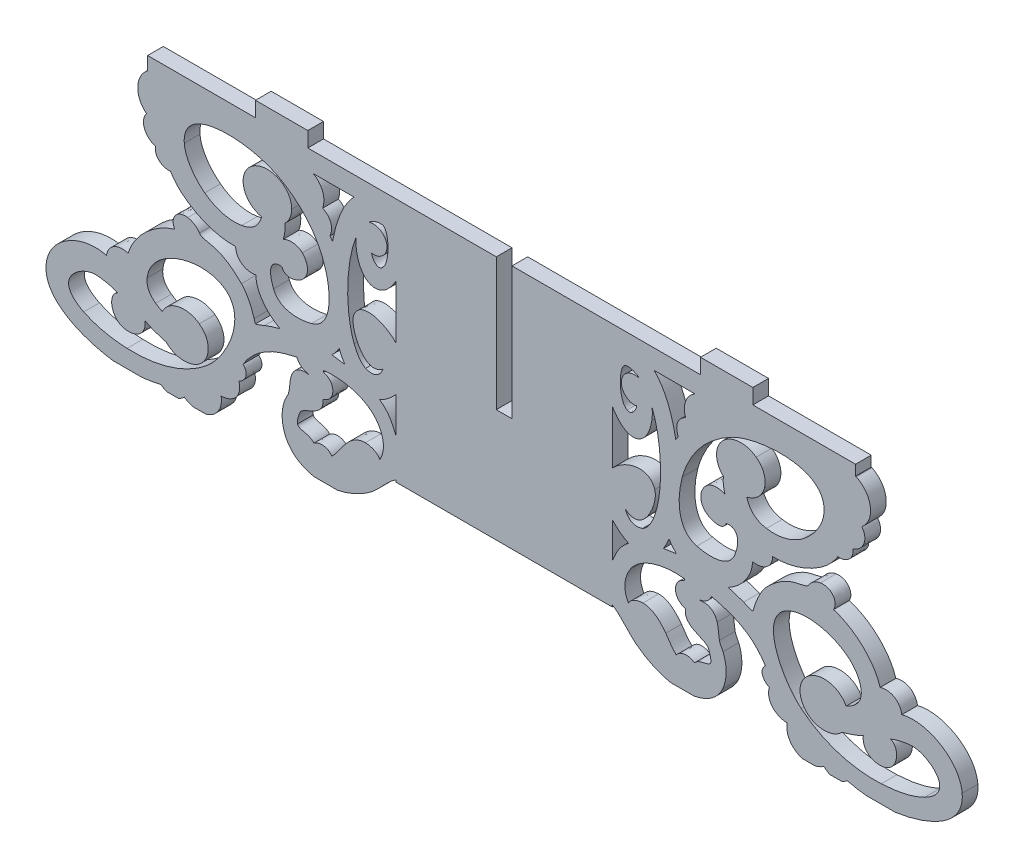
from build123d import *

# Parameters (mm, degrees)
RESSALTO_EXTRUS_O1_DEPTH = 2


with BuildPart() as part:
    # Model → Ressalto-extrusão1 (new body)
    with BuildSketch(Plane.XY):
        with BuildLine():
            Line((-5.6284, -112.7453), (-5.6464, -112.5024))
            add(Edge.make_bspline(
                [(-5.6464, -112.5024), (-6.5419, -112.9865), (-7.8893, -114.6814), (-8.6517, -115.2757)],
                knots=[0.00990099, 0.00990099, 0.00990099, 0.00990099, 0.01980198, 0.01980198, 0.01980198, 0.01980198], degree=3))
            add(Edge.make_bspline(
                [(-8.6517, -115.2757), (-9.9492, -116.2871), (-11.4791, -117.04), (-13.1021, -117.3563)],
                knots=[0.01980198, 0.01980198, 0.01980198, 0.01980198, 0.02970297, 0.02970297, 0.02970297, 0.02970297], degree=3))
            Line((-13.1021, -117.3563), (-16.0542, -117.3569))
            add(Edge.make_bspline(
                [(-16.0542, -117.3569), (-17.6074, -117.0704), (-18.9753, -116.2771), (-19.6727, -114.8027)],
                knots=[0.03960396, 0.03960396, 0.03960396, 0.03960396, 0.04950495, 0.04950495, 0.04950495, 0.04950495], degree=3))
            add(Edge.make_bspline(
                [(-19.6727, -114.8027), (-20.2748, -113.5296), (-20.309, -111.9264), (-19.7445, -110.6272)],
                knots=[0.04950495, 0.04950495, 0.04950495, 0.04950495, 0.059405941, 0.059405941, 0.059405941, 0.059405941], degree=3))
            add(Edge.make_bspline(
                [(-19.7445, -110.6272), (-19.5924, -110.2771), (-19.3699, -109.9824), (-19.2888, -109.595)],
                knots=[0.059405941, 0.059405941, 0.059405941, 0.059405941, 0.069306931, 0.069306931, 0.069306931, 0.069306931], degree=3))
            add(Edge.make_bspline(
                [(-19.2888, -109.595), (-19.1614, -108.9856), (-19.1819, -108.3312), (-18.999, -107.7315)],
                knots=[0.069306931, 0.069306931, 0.069306931, 0.069306931, 0.079207921, 0.079207921, 0.079207921, 0.079207921], degree=3))
            add(Edge.make_bspline(
                [(-18.999, -107.7315), (-18.6689, -106.6497), (-17.8333, -106.246), (-16.8102, -106.4384)],
                knots=[0.079207921, 0.079207921, 0.079207921, 0.079207921, 0.089108911, 0.089108911, 0.089108911, 0.089108911], degree=3))
            add(Edge.make_bspline(
                [(-16.8102, -106.4384), (-16.8066, -106.4196), (-16.8024, -106.4007), (-16.7979, -106.3817)],
                knots=[0.089108911, 0.089108911, 0.089108911, 0.089108911, 0.099009901, 0.099009901, 0.099009901, 0.099009901], degree=3))
            add(Edge.make_bspline(
                [(-16.7979, -106.3817), (-17.4996, -106.2832), (-17.9964, -105.8964), (-18.281, -105.2638)],
                knots=[0.099009901, 0.099009901, 0.099009901, 0.099009901, 0.108910891, 0.108910891, 0.108910891, 0.108910891], degree=3))
            Line((-18.281, -105.2638), (-19.6289, -105.6073))
            add(Edge.make_bspline(
                [(-19.6289, -105.6073), (-21.9055, -106.2199), (-23.8126, -107.3723), (-25.137, -109.472)],
                knots=[0.118811881, 0.118811881, 0.118811881, 0.118811881, 0.128712871, 0.128712871, 0.128712871, 0.128712871], degree=3))
            add(Edge.make_bspline(
                [(-25.137, -109.472), (-24.3471, -110.1811), (-24.768, -111.1844), (-25.6484, -111.6117)],
                knots=[0.128712871, 0.128712871, 0.128712871, 0.128712871, 0.138613861, 0.138613861, 0.138613861, 0.138613861], degree=3))
            add(Edge.make_bspline(
                [(-25.6484, -111.6117), (-25.2197, -113.1217), (-26.2828, -114.3014), (-27.9206, -114.3964)],
                knots=[0.138613861, 0.138613861, 0.138613861, 0.138613861, 0.148514851, 0.148514851, 0.148514851, 0.148514851], degree=3))
            add(Edge.make_bspline(
                [(-27.9206, -114.3964), (-27.6704, -115.807), (-28.5691, -117.0098), (-29.8849, -117.352)],
                knots=[0.148514851, 0.148514851, 0.148514851, 0.148514851, 0.158415842, 0.158415842, 0.158415842, 0.158415842], degree=3))
            Line((-29.8849, -117.352), (-31.4771, -117.3528))
            add(Edge.make_bspline(
                [(-31.4771, -117.3528), (-31.8723, -117.2547), (-32.2526, -117.0856), (-32.6065, -116.8521)],
                knots=[0.168316832, 0.168316832, 0.168316832, 0.168316832, 0.178217822, 0.178217822, 0.178217822, 0.178217822], degree=3))
            add(Edge.make_bspline(
                [(-32.6065, -116.8521), (-32.7813, -117.0214), (-33.1597, -117.3166), (-33.3867, -117.362)],
                knots=[0.178217822, 0.178217822, 0.178217822, 0.178217822, 0.188118812, 0.188118812, 0.188118812, 0.188118812], degree=3))
            Line((-33.3867, -117.362), (-34.8157, -117.362))
            add(Edge.make_bspline(
                [(-34.8157, -117.362), (-35.0116, -117.3252), (-35.4128, -117.07), (-35.5882, -116.9422)],
                knots=[0.198019802, 0.198019802, 0.198019802, 0.198019802, 0.207920792, 0.207920792, 0.207920792, 0.207920792], degree=3))
            add(Edge.make_bspline(
                [(-35.5882, -116.9422), (-36.1338, -117.086), (-37.442, -117.3298), (-37.9546, -117.362)],
                knots=[0.207920792, 0.207920792, 0.207920792, 0.207920792, 0.217821782, 0.217821782, 0.217821782, 0.217821782], degree=3))
            Line((-37.9546, -117.362), (-41.6837, -117.3591))
            add(Edge.make_bspline(
                [(-41.6837, -117.3591), (-44.9016, -116.9194), (-50.559, -115.1316), (-50.1979, -111.0071)],
                knots=[0.227722772, 0.227722772, 0.227722772, 0.227722772, 0.237623762, 0.237623762, 0.237623762, 0.237623762], degree=3))
            add(Edge.make_bspline(
                [(-50.1979, -111.0071), (-49.9051, -107.6597), (-45.7279, -105.3202), (-42.5097, -106.1811)],
                knots=[0.237623762, 0.237623762, 0.237623762, 0.237623762, 0.247524752, 0.247524752, 0.247524752, 0.247524752], degree=3))
            add(Edge.make_bspline(
                [(-42.5097, -106.1811), (-42.3406, -104.9368), (-41.1513, -104.1223), (-39.7553, -104.5529)],
                knots=[0.247524752, 0.247524752, 0.247524752, 0.247524752, 0.257425743, 0.257425743, 0.257425743, 0.257425743], degree=3))
            add(Edge.make_bspline(
                [(-39.7553, -104.5529), (-38.9652, -101.9343), (-36.3648, -99.6933), (-33.825, -98.9411)],
                knots=[0.257425743, 0.257425743, 0.257425743, 0.257425743, 0.267326733, 0.267326733, 0.267326733, 0.267326733], degree=3))
            add(Edge.make_bspline(
                [(-33.825, -98.9411), (-34.4145, -97.9132), (-33.6513, -96.6265), (-32.1639, -96.8236)],
                knots=[0.267326733, 0.267326733, 0.267326733, 0.267326733, 0.277227723, 0.277227723, 0.277227723, 0.277227723], degree=3))
            add(Edge.make_bspline(
                [(-32.1639, -96.8236), (-31.6489, -96.8918), (-30.977, -97.2747), (-30.6727, -97.7933)],
                knots=[0.277227723, 0.277227723, 0.277227723, 0.277227723, 0.287128713, 0.287128713, 0.287128713, 0.287128713], degree=3))
            add(Edge.make_bspline(
                [(-30.6727, -97.7933), (-30.2008, -98.5978), (-28.3124, -97.6373), (-25.3267, -100.6883)],
                knots=[0.287128713, 0.287128713, 0.287128713, 0.287128713, 0.297029703, 0.297029703, 0.297029703, 0.297029703], degree=3))
            add(Edge.make_bspline(
                [(-25.3267, -100.6883), (-24.602, -101.4287), (-24.0346, -102.6503), (-23.718, -103.7243)],
                knots=[0.297029703, 0.297029703, 0.297029703, 0.297029703, 0.306930693, 0.306930693, 0.306930693, 0.306930693], degree=3))
            add(Edge.make_bspline(
                [(-23.718, -103.7243), (-23.6918, -103.8135), (-23.611, -104.1406), (-23.5594, -104.2593)],
                knots=[0.306930693, 0.306930693, 0.306930693, 0.306930693, 0.316831683, 0.316831683, 0.316831683, 0.316831683], degree=3))
            add(Edge.make_bspline(
                [(-23.5594, -104.2593), (-23.2891, -104.2271), (-22.6447, -103.9373), (-22.3768, -103.8363)],
                knots=[0.316831683, 0.316831683, 0.316831683, 0.316831683, 0.326732673, 0.326732673, 0.326732673, 0.326732673], degree=3))
            add(Edge.make_bspline(
                [(-22.3768, -103.8363), (-21.7257, -103.591), (-21.0761, -103.3756), (-20.4179, -103.1989)],
                knots=[0.326732673, 0.326732673, 0.326732673, 0.326732673, 0.336633663, 0.336633663, 0.336633663, 0.336633663], degree=3))
            add(Edge.make_bspline(
                [(-20.4179, -103.1989), (-22.012, -102.3364), (-23.4449, -100.7002), (-23.5064, -98.8133)],
                knots=[0.336633663, 0.336633663, 0.336633663, 0.336633663, 0.346534653, 0.346534653, 0.346534653, 0.346534653], degree=3))
            add(Edge.make_bspline(
                [(-23.5064, -98.8133), (-24.7892, -99.0637), (-26.0243, -98.3309), (-26.0724, -96.9712)],
                knots=[0.346534653, 0.346534653, 0.346534653, 0.346534653, 0.356435644, 0.356435644, 0.356435644, 0.356435644], degree=3))
            add(Edge.make_bspline(
                [(-26.0724, -96.9712), (-28.4957, -97.0677), (-31.1466, -96.0514), (-32.9791, -94.4712)],
                knots=[0.356435644, 0.356435644, 0.356435644, 0.356435644, 0.366336634, 0.366336634, 0.366336634, 0.366336634], degree=3))
            add(Edge.make_bspline(
                [(-32.9791, -94.4712), (-33.492, -94.0288), (-33.9776, -93.4401), (-34.3711, -92.825)],
                knots=[0.366336634, 0.366336634, 0.366336634, 0.366336634, 0.376237624, 0.376237624, 0.376237624, 0.376237624], degree=3))
            add(Edge.make_bspline(
                [(-34.3711, -92.825), (-35.3634, -92.9517), (-36.4953, -92.1626), (-36.2723, -91.0278)],
                knots=[0.376237624, 0.376237624, 0.376237624, 0.376237624, 0.386138614, 0.386138614, 0.386138614, 0.386138614], degree=3))
            add(Edge.make_bspline(
                [(-36.2723, -91.0278), (-37.635, -90.5862), (-38.2812, -89.0905), (-37.4127, -87.9969)],
                knots=[0.386138614, 0.386138614, 0.386138614, 0.386138614, 0.396039604, 0.396039604, 0.396039604, 0.396039604], degree=3))
            add(Edge.make_bspline(
                [(-37.4127, -87.9969), (-39.0338, -86.6952), (-38.818, -84.3676), (-37.2753, -83.1991)],
                knots=[0.396039604, 0.396039604, 0.396039604, 0.396039604, 0.405940594, 0.405940594, 0.405940594, 0.405940594], degree=3))
            Line((-37.2753, -83.1991), (-37.2753, -81.5107))
            Line((-37.2753, -81.5107), (-23.5478, -81.5107))
            Line((-23.5478, -81.5107), (-23.5478, -79.5846))
            Line((-23.5478, -79.5846), (-16.8811, -79.5846))
            Line((-16.8811, -79.5846), (-16.8811, -81.5107))
            Line((-16.8811, -81.5107), (7.1189, -81.5107))
            Line((7.1189, -81.5107), (7.1189, -98.3678))
            Line((7.1189, -98.3678), (9.1189, -98.3678))
            Line((9.1189, -98.3678), (9.1189, -81.5107))
            Line((9.1189, -81.5107), (33.1189, -81.5107))
            Line((33.1189, -81.5107), (33.1189, -79.5846))
            Line((33.1189, -79.5846), (39.7856, -79.5846))
            Line((39.7856, -79.5846), (39.7856, -81.5107))
            Line((39.7856, -81.5107), (52.8602, -81.5107))
            Line((52.8602, -81.5107), (52.8602, -82.8287))
            Line((52.8602, -82.8287), (52.8959, -82.8287))
            Line((52.8959, -82.8287), (52.9623, -82.861))
            add(Edge.make_bspline(
                [(52.9623, -82.861), (54.9872, -83.848), (55.4482, -86.5534), (53.6504, -87.9969)],
                knots=[0.574257426, 0.574257426, 0.574257426, 0.574257426, 0.584158416, 0.584158416, 0.584158416, 0.584158416], degree=3))
            add(Edge.make_bspline(
                [(53.6504, -87.9969), (54.519, -89.0905), (53.8727, -90.5862), (52.5101, -91.0278)],
                knots=[0.584158416, 0.584158416, 0.584158416, 0.584158416, 0.594059406, 0.594059406, 0.594059406, 0.594059406], degree=3))
            add(Edge.make_bspline(
                [(52.5101, -91.0278), (52.733, -92.1626), (51.6012, -92.9517), (50.6088, -92.825)],
                knots=[0.594059406, 0.594059406, 0.594059406, 0.594059406, 0.603960396, 0.603960396, 0.603960396, 0.603960396], degree=3))
            add(Edge.make_bspline(
                [(50.6088, -92.825), (50.2153, -93.4401), (49.7298, -94.0288), (49.2168, -94.4712)],
                knots=[0.603960396, 0.603960396, 0.603960396, 0.603960396, 0.613861386, 0.613861386, 0.613861386, 0.613861386], degree=3))
            add(Edge.make_bspline(
                [(49.2168, -94.4712), (47.3843, -96.0514), (44.7334, -97.0677), (42.3101, -96.9712)],
                knots=[0.613861386, 0.613861386, 0.613861386, 0.613861386, 0.623762376, 0.623762376, 0.623762376, 0.623762376], degree=3))
            add(Edge.make_bspline(
                [(42.3101, -96.9712), (42.262, -98.3309), (41.027, -99.0637), (39.7442, -98.8133)],
                knots=[0.623762376, 0.623762376, 0.623762376, 0.623762376, 0.633663366, 0.633663366, 0.633663366, 0.633663366], degree=3))
            add(Edge.make_bspline(
                [(39.7442, -98.8133), (39.6827, -100.7002), (38.2497, -102.3364), (36.6556, -103.1989)],
                knots=[0.633663366, 0.633663366, 0.633663366, 0.633663366, 0.643564356, 0.643564356, 0.643564356, 0.643564356], degree=3))
            add(Edge.make_bspline(
                [(36.6556, -103.1989), (37.3138, -103.3756), (37.9634, -103.591), (38.6145, -103.8363)],
                knots=[0.643564356, 0.643564356, 0.643564356, 0.643564356, 0.653465347, 0.653465347, 0.653465347, 0.653465347], degree=3))
            add(Edge.make_bspline(
                [(38.6145, -103.8363), (38.8825, -103.9373), (39.5268, -104.2271), (39.7971, -104.2593)],
                knots=[0.653465347, 0.653465347, 0.653465347, 0.653465347, 0.663366337, 0.663366337, 0.663366337, 0.663366337], degree=3))
            add(Edge.make_bspline(
                [(39.7971, -104.2593), (39.8487, -104.1406), (39.9295, -103.8135), (39.9557, -103.7243)],
                knots=[0.663366337, 0.663366337, 0.663366337, 0.663366337, 0.673267327, 0.673267327, 0.673267327, 0.673267327], degree=3))
            add(Edge.make_bspline(
                [(39.9557, -103.7243), (40.2723, -102.6503), (40.8398, -101.4287), (41.5644, -100.6883)],
                knots=[0.673267327, 0.673267327, 0.673267327, 0.673267327, 0.683168317, 0.683168317, 0.683168317, 0.683168317], degree=3))
            add(Edge.make_bspline(
                [(41.5644, -100.6883), (44.5501, -97.6373), (46.4385, -98.5978), (46.9105, -97.7933)],
                knots=[0.683168317, 0.683168317, 0.683168317, 0.683168317, 0.693069307, 0.693069307, 0.693069307, 0.693069307], degree=3))
            add(Edge.make_bspline(
                [(46.9105, -97.7933), (47.2147, -97.2747), (47.8867, -96.8918), (48.4016, -96.8236)],
                knots=[0.693069307, 0.693069307, 0.693069307, 0.693069307, 0.702970297, 0.702970297, 0.702970297, 0.702970297], degree=3))
            add(Edge.make_bspline(
                [(48.4016, -96.8236), (49.8891, -96.6265), (50.6522, -97.9132), (50.0628, -98.9411)],
                knots=[0.702970297, 0.702970297, 0.702970297, 0.702970297, 0.712871287, 0.712871287, 0.712871287, 0.712871287], degree=3))
            add(Edge.make_bspline(
                [(50.0628, -98.9411), (52.6026, -99.6933), (55.2029, -101.9343), (55.9931, -104.5529)],
                knots=[0.712871287, 0.712871287, 0.712871287, 0.712871287, 0.722772277, 0.722772277, 0.722772277, 0.722772277], degree=3))
            add(Edge.make_bspline(
                [(55.9931, -104.5529), (57.389, -104.1223), (58.5783, -104.9368), (58.7475, -106.1811)],
                knots=[0.722772277, 0.722772277, 0.722772277, 0.722772277, 0.732673267, 0.732673267, 0.732673267, 0.732673267], degree=3))
            add(Edge.make_bspline(
                [(58.7475, -106.1811), (61.9656, -105.3202), (66.1428, -107.6597), (66.4357, -111.0071)],
                knots=[0.732673267, 0.732673267, 0.732673267, 0.732673267, 0.742574257, 0.742574257, 0.742574257, 0.742574257], degree=3))
            add(Edge.make_bspline(
                [(66.4357, -111.0071), (66.7967, -115.1316), (61.1393, -116.9194), (57.9215, -117.3591)],
                knots=[0.742574257, 0.742574257, 0.742574257, 0.742574257, 0.752475248, 0.752475248, 0.752475248, 0.752475248], degree=3))
            Line((57.9215, -117.3591), (54.1924, -117.362))
            add(Edge.make_bspline(
                [(54.1924, -117.362), (53.6797, -117.3298), (52.3716, -117.086), (51.826, -116.9422)],
                knots=[0.762376238, 0.762376238, 0.762376238, 0.762376238, 0.772277228, 0.772277228, 0.772277228, 0.772277228], degree=3))
            add(Edge.make_bspline(
                [(51.826, -116.9422), (51.6505, -117.07), (51.2493, -117.3252), (51.0535, -117.362)],
                knots=[0.772277228, 0.772277228, 0.772277228, 0.772277228, 0.782178218, 0.782178218, 0.782178218, 0.782178218], degree=3))
            Line((51.0535, -117.362), (49.6245, -117.362))
            add(Edge.make_bspline(
                [(49.6245, -117.362), (49.3974, -117.3166), (49.019, -117.0214), (48.8442, -116.8521)],
                knots=[0.792079208, 0.792079208, 0.792079208, 0.792079208, 0.801980198, 0.801980198, 0.801980198, 0.801980198], degree=3))
            add(Edge.make_bspline(
                [(48.8442, -116.8521), (48.4903, -117.0856), (48.11, -117.2547), (47.7148, -117.3528)],
                knots=[0.801980198, 0.801980198, 0.801980198, 0.801980198, 0.811881188, 0.811881188, 0.811881188, 0.811881188], degree=3))
            Line((47.7148, -117.3528), (46.1226, -117.352))
            add(Edge.make_bspline(
                [(46.1226, -117.352), (44.8069, -117.0098), (43.9081, -115.807), (44.1584, -114.3964)],
                knots=[0.821782178, 0.821782178, 0.821782178, 0.821782178, 0.831683168, 0.831683168, 0.831683168, 0.831683168], degree=3))
            add(Edge.make_bspline(
                [(44.1584, -114.3964), (42.5205, -114.3014), (41.4574, -113.1217), (41.8862, -111.6117)],
                knots=[0.831683168, 0.831683168, 0.831683168, 0.831683168, 0.841584158, 0.841584158, 0.841584158, 0.841584158], degree=3))
            add(Edge.make_bspline(
                [(41.8862, -111.6117), (41.0057, -111.1844), (40.5849, -110.1811), (41.3748, -109.472)],
                knots=[0.841584158, 0.841584158, 0.841584158, 0.841584158, 0.851485149, 0.851485149, 0.851485149, 0.851485149], degree=3))
            add(Edge.make_bspline(
                [(41.3748, -109.472), (40.0503, -107.3723), (38.1433, -106.2199), (35.8666, -105.6073)],
                knots=[0.851485149, 0.851485149, 0.851485149, 0.851485149, 0.861386139, 0.861386139, 0.861386139, 0.861386139], degree=3))
            Line((35.8666, -105.6073), (34.5187, -105.2638))
            add(Edge.make_bspline(
                [(34.5187, -105.2638), (34.2342, -105.8964), (33.7373, -106.2832), (33.0357, -106.3817)],
                knots=[0.871287129, 0.871287129, 0.871287129, 0.871287129, 0.881188119, 0.881188119, 0.881188119, 0.881188119], degree=3))
            add(Edge.make_bspline(
                [(33.0357, -106.3817), (33.0401, -106.4007), (33.0443, -106.4196), (33.048, -106.4384)],
                knots=[0.881188119, 0.881188119, 0.881188119, 0.881188119, 0.891089109, 0.891089109, 0.891089109, 0.891089109], degree=3))
            add(Edge.make_bspline(
                [(33.048, -106.4384), (34.071, -106.246), (34.9066, -106.6497), (35.2367, -107.7315)],
                knots=[0.891089109, 0.891089109, 0.891089109, 0.891089109, 0.900990099, 0.900990099, 0.900990099, 0.900990099], degree=3))
            add(Edge.make_bspline(
                [(35.2367, -107.7315), (35.4196, -108.3312), (35.3992, -108.9856), (35.5266, -109.595)],
                knots=[0.900990099, 0.900990099, 0.900990099, 0.900990099, 0.910891089, 0.910891089, 0.910891089, 0.910891089], degree=3))
            add(Edge.make_bspline(
                [(35.5266, -109.595), (35.6076, -109.9824), (35.8302, -110.2771), (35.9823, -110.6272)],
                knots=[0.910891089, 0.910891089, 0.910891089, 0.910891089, 0.920792079, 0.920792079, 0.920792079, 0.920792079], degree=3))
            add(Edge.make_bspline(
                [(35.9823, -110.6272), (36.5467, -111.9264), (36.5126, -113.5296), (35.9104, -114.8027)],
                knots=[0.920792079, 0.920792079, 0.920792079, 0.920792079, 0.930693069, 0.930693069, 0.930693069, 0.930693069], degree=3))
            add(Edge.make_bspline(
                [(35.9104, -114.8027), (35.2131, -116.2771), (33.8452, -117.0704), (32.2919, -117.3569)],
                knots=[0.930693069, 0.930693069, 0.930693069, 0.930693069, 0.940594059, 0.940594059, 0.940594059, 0.940594059], degree=3))
            Line((32.2919, -117.3569), (29.3398, -117.3563))
            add(Edge.make_bspline(
                [(29.3398, -117.3563), (27.7168, -117.04), (26.1869, -116.2871), (24.8894, -115.2757)],
                knots=[0.95049505, 0.95049505, 0.95049505, 0.95049505, 0.96039604, 0.96039604, 0.96039604, 0.96039604], degree=3))
            add(Edge.make_bspline(
                [(24.8894, -115.2757), (24.127, -114.6814), (22.7796, -112.9865), (21.8841, -112.5024)],
                knots=[0.96039604, 0.96039604, 0.96039604, 0.96039604, 0.97029703, 0.97029703, 0.97029703, 0.97029703], degree=3))
            Line((21.8841, -112.5024), (21.8661, -112.7453))
            add(Edge.make_bspline(
                [(21.8661, -112.7453), (12.8258, -112.7453), (3.4119, -112.7453), (-5.6284, -112.7453)],
                knots=[0.98019802, 0.98019802, 0.98019802, 0.98019802, 1, 1, 1, 1], degree=3))
        make_face()
        with BuildLine():
            Line((-10.9876, -83.9801), (-16.2025, -83.9801))
            add(Edge.make_bspline(
                [(-16.2025, -83.9801), (-15.1507, -84.5589), (-14.5218, -85.7771), (-14.9827, -87.1985)],
                knots=[0, 0, 0, 0, 0.166666667, 0.166666667, 0.166666667, 0.166666667], degree=3))
            add(Edge.make_bspline(
                [(-14.9827, -87.1985), (-13.9248, -87.7097), (-13.6065, -88.7057), (-14.0462, -89.782)],
                knots=[0.166666667, 0.166666667, 0.166666667, 0.166666667, 0.333333333, 0.333333333, 0.333333333, 0.333333333], degree=3))
            add(Edge.make_bspline(
                [(-14.0462, -89.782), (-13.9394, -89.9313), (-13.8344, -90.0899), (-13.7323, -90.2521)],
                knots=[0.333333333, 0.333333333, 0.333333333, 0.333333333, 0.5, 0.5, 0.5, 0.5], degree=3))
            add(Edge.make_bspline(
                [(-13.7323, -90.2521), (-13.3251, -87.9243), (-12.4877, -85.4672), (-10.9876, -83.9801)],
                knots=[0.5, 0.5, 0.5, 0.5, 0.666666667, 0.666666667, 0.666666667, 0.666666667], degree=3))
        make_face(mode=Mode.SUBTRACT)
        with BuildLine():
            Line((32.4403, -83.9801), (27.2253, -83.9801))
            add(Edge.make_bspline(
                [(27.2253, -83.9801), (28.7254, -85.4672), (29.5629, -87.9243), (29.97, -90.2521)],
                knots=[0, 0, 0, 0, 0.166666667, 0.166666667, 0.166666667, 0.166666667], degree=3))
            add(Edge.make_bspline(
                [(29.97, -90.2521), (30.0721, -90.0899), (30.1772, -89.9313), (30.2839, -89.782)],
                knots=[0.166666667, 0.166666667, 0.166666667, 0.166666667, 0.333333333, 0.333333333, 0.333333333, 0.333333333], degree=3))
            add(Edge.make_bspline(
                [(30.2839, -89.782), (29.8442, -88.7057), (30.1626, -87.7097), (31.2204, -87.1985)],
                knots=[0.333333333, 0.333333333, 0.333333333, 0.333333333, 0.5, 0.5, 0.5, 0.5], degree=3))
            add(Edge.make_bspline(
                [(31.2204, -87.1985), (30.7596, -85.7771), (31.3885, -84.5589), (32.4403, -83.9801)],
                knots=[0.5, 0.5, 0.5, 0.5, 0.666666667, 0.666666667, 0.666666667, 0.666666667], degree=3))
        make_face(mode=Mode.SUBTRACT)
        with BuildLine():
            Line((21.8983, -107.6195), (21.8983, -103.0943))
            add(Edge.make_bspline(
                [(21.8983, -103.0943), (22.4767, -103.7415), (23.2107, -104.3434), (23.9781, -104.6802)],
                knots=[0.25, 0.25, 0.25, 0.25, 0.5, 0.5, 0.5, 0.5], degree=3))
            add(Edge.make_bspline(
                [(23.9781, -104.6802), (22.8318, -105.493), (22.4114, -106.3816), (21.8983, -107.6195)],
                knots=[0.5, 0.5, 0.5, 0.5, 1, 1, 1, 1], degree=3))
        make_face(mode=Mode.SUBTRACT)
        with BuildLine():
            Line((21.8983, -97.4057), (21.8983, -90.5812))
            add(Edge.make_bspline(
                [(21.8983, -90.5812), (23.715, -93.8349), (26.3849, -93.1363), (26.9173, -89.6854)],
                knots=[0.363636364, 0.363636364, 0.363636364, 0.363636364, 0.454545455, 0.454545455, 0.454545455, 0.454545455], degree=3))
            add(Edge.make_bspline(
                [(26.9173, -89.6854), (26.9939, -89.1892), (27.0085, -88.6836), (26.9564, -88.2068)],
                knots=[0.454545455, 0.454545455, 0.454545455, 0.454545455, 0.545454545, 0.545454545, 0.545454545, 0.545454545], degree=3))
            add(Edge.make_bspline(
                [(26.9564, -88.2068), (28.2487, -91.4505), (28.451, -96.9108), (27.213, -100.145)],
                knots=[0.545454545, 0.545454545, 0.545454545, 0.545454545, 0.636363636, 0.636363636, 0.636363636, 0.636363636], degree=3))
            add(Edge.make_bspline(
                [(27.213, -100.145), (26.9098, -100.9371), (26.4428, -101.7745), (25.7631, -102.1337)],
                knots=[0.636363636, 0.636363636, 0.636363636, 0.636363636, 0.727272727, 0.727272727, 0.727272727, 0.727272727], degree=3))
            add(Edge.make_bspline(
                [(25.7631, -102.1337), (25.054, -102.3989), (24.3, -102.3651), (23.8014, -101.6136)],
                knots=[0.727272727, 0.727272727, 0.727272727, 0.727272727, 0.818181818, 0.818181818, 0.818181818, 0.818181818], degree=3))
            add(Edge.make_bspline(
                [(23.8014, -101.6136), (23.6985, -101.4585), (23.6152, -101.2845), (23.5508, -101.1004)],
                knots=[0.818181818, 0.818181818, 0.818181818, 0.818181818, 1, 1, 1, 1], degree=3))
            add(Edge.make_bspline(
                [(23.5508, -101.1004), (23.9717, -101.4816), (24.5568, -101.6481), (25.0819, -101.5176)],
                knots=[0, 0, 0, 0, 0.090909091, 0.090909091, 0.090909091, 0.090909091], degree=3))
            add(Edge.make_bspline(
                [(25.0819, -101.5176), (26.5124, -101.1622), (27.6791, -98.283), (27.2955, -97.0934)],
                knots=[0.090909091, 0.090909091, 0.090909091, 0.090909091, 0.181818182, 0.181818182, 0.181818182, 0.181818182], degree=3))
            add(Edge.make_bspline(
                [(27.2955, -97.0934), (26.5745, -94.8575), (23.4797, -95.7308), (21.8983, -97.4057)],
                knots=[0.181818182, 0.181818182, 0.181818182, 0.181818182, 0.272727273, 0.272727273, 0.272727273, 0.272727273], degree=3))
        make_face(mode=Mode.SUBTRACT)
        with BuildLine():
            Line((30.061, -102.7829), (28.4015, -103.0293))
            add(Edge.make_bspline(
                [(28.4015, -103.0293), (28.6801, -102.5939), (28.9165, -102.111), (29.1159, -101.617)],
                knots=[0.25, 0.25, 0.25, 0.25, 0.5, 0.5, 0.5, 0.5], degree=3))
            add(Edge.make_bspline(
                [(29.1159, -101.617), (29.3835, -102.0615), (29.6983, -102.454), (30.061, -102.7829)],
                knots=[0.5, 0.5, 0.5, 0.5, 1, 1, 1, 1], degree=3))
        make_face(mode=Mode.SUBTRACT)
        with BuildLine():
            Line((-5.6605, -107.6195), (-5.6605, -103.0943))
            add(Edge.make_bspline(
                [(-5.6605, -103.0943), (-6.239, -103.7415), (-6.9729, -104.3434), (-7.7404, -104.6802)],
                knots=[0.25, 0.25, 0.25, 0.25, 0.5, 0.5, 0.5, 0.5], degree=3))
            add(Edge.make_bspline(
                [(-7.7404, -104.6802), (-6.5941, -105.493), (-6.1737, -106.3816), (-5.6605, -107.6195)],
                knots=[0.5, 0.5, 0.5, 0.5, 1, 1, 1, 1], degree=3))
        make_face(mode=Mode.SUBTRACT)
        with BuildLine():
            Line((-5.6605, -97.4057), (-5.6605, -90.5812))
            add(Edge.make_bspline(
                [(-5.6605, -90.5812), (-7.4773, -93.8349), (-10.1472, -93.1363), (-10.6795, -89.6854)],
                knots=[0.363636364, 0.363636364, 0.363636364, 0.363636364, 0.454545455, 0.454545455, 0.454545455, 0.454545455], degree=3))
            add(Edge.make_bspline(
                [(-10.6795, -89.6854), (-10.7561, -89.1892), (-10.7708, -88.6836), (-10.7187, -88.2068)],
                knots=[0.454545455, 0.454545455, 0.454545455, 0.454545455, 0.545454545, 0.545454545, 0.545454545, 0.545454545], degree=3))
            add(Edge.make_bspline(
                [(-10.7187, -88.2068), (-12.011, -91.4505), (-12.2132, -96.9108), (-10.9753, -100.145)],
                knots=[0.545454545, 0.545454545, 0.545454545, 0.545454545, 0.636363636, 0.636363636, 0.636363636, 0.636363636], degree=3))
            add(Edge.make_bspline(
                [(-10.9753, -100.145), (-10.6721, -100.9371), (-10.205, -101.7745), (-9.5254, -102.1337)],
                knots=[0.636363636, 0.636363636, 0.636363636, 0.636363636, 0.727272727, 0.727272727, 0.727272727, 0.727272727], degree=3))
            add(Edge.make_bspline(
                [(-9.5254, -102.1337), (-8.8163, -102.3989), (-8.0623, -102.3651), (-7.5637, -101.6136)],
                knots=[0.727272727, 0.727272727, 0.727272727, 0.727272727, 0.818181818, 0.818181818, 0.818181818, 0.818181818], degree=3))
            add(Edge.make_bspline(
                [(-7.5637, -101.6136), (-7.4608, -101.4585), (-7.3775, -101.2845), (-7.3131, -101.1004)],
                knots=[0.818181818, 0.818181818, 0.818181818, 0.818181818, 1, 1, 1, 1], degree=3))
            add(Edge.make_bspline(
                [(-7.3131, -101.1004), (-7.734, -101.4816), (-8.3191, -101.6481), (-8.8441, -101.5176)],
                knots=[0, 0, 0, 0, 0.090909091, 0.090909091, 0.090909091, 0.090909091], degree=3))
            add(Edge.make_bspline(
                [(-8.8441, -101.5176), (-10.2747, -101.1622), (-11.4413, -98.283), (-11.0577, -97.0934)],
                knots=[0.090909091, 0.090909091, 0.090909091, 0.090909091, 0.181818182, 0.181818182, 0.181818182, 0.181818182], degree=3))
            add(Edge.make_bspline(
                [(-11.0577, -97.0934), (-10.3368, -94.8575), (-7.2419, -95.7308), (-5.6605, -97.4057)],
                knots=[0.181818182, 0.181818182, 0.181818182, 0.181818182, 0.272727273, 0.272727273, 0.272727273, 0.272727273], degree=3))
        make_face(mode=Mode.SUBTRACT)
        with BuildLine():
            Line((-13.8232, -102.7829), (-12.1638, -103.0293))
            add(Edge.make_bspline(
                [(-12.1638, -103.0293), (-12.4424, -102.5939), (-12.6788, -102.111), (-12.8781, -101.617)],
                knots=[0.25, 0.25, 0.25, 0.25, 0.5, 0.5, 0.5, 0.5], degree=3))
            add(Edge.make_bspline(
                [(-12.8781, -101.617), (-13.1457, -102.0615), (-13.4606, -102.454), (-13.8232, -102.7829)],
                knots=[0.5, 0.5, 0.5, 0.5, 1, 1, 1, 1], degree=3))
        make_face(mode=Mode.SUBTRACT)
        with BuildLine():
            add(Edge.make_bspline(
                [(25.3652, -85.8031), (23.4778, -85.2427), (22.2258, -87.425), (23.6524, -88.664)],
                knots=[0, 0, 0, 0, 0.166666667, 0.166666667, 0.166666667, 0.166666667], degree=3))
            add(Edge.make_bspline(
                [(23.6524, -88.664), (24.0428, -89.0031), (24.532, -89.1242), (25.0001, -89.0115)],
                knots=[0.166666667, 0.166666667, 0.166666667, 0.166666667, 0.333333333, 0.333333333, 0.333333333, 0.333333333], degree=3))
            add(Edge.make_bspline(
                [(25.0001, -89.0115), (24.9505, -89.519), (24.3805, -90.3951), (23.7771, -90.072)],
                knots=[0.333333333, 0.333333333, 0.333333333, 0.333333333, 0.5, 0.5, 0.5, 0.5], degree=3))
            add(Edge.make_bspline(
                [(23.7771, -90.072), (22.6078, -89.4459), (22.6642, -85.3539), (23.6446, -85.2345)],
                knots=[0.5, 0.5, 0.5, 0.5, 0.666666667, 0.666666667, 0.666666667, 0.666666667], degree=3))
            add(Edge.make_bspline(
                [(23.6446, -85.2345), (24.2518, -85.1606), (24.8926, -85.4231), (25.3652, -85.8031)],
                knots=[0.666666667, 0.666666667, 0.666666667, 0.666666667, 1, 1, 1, 1], degree=3))
        make_face(mode=Mode.SUBTRACT)
        with BuildLine():
            add(Edge.make_bspline(
                [(36.0381, -91.2717), (35.9571, -91.9263), (36.0478, -92.518), (36.2461, -93.1381)],
                knots=[0, 0, 0, 0, 0.058823529, 0.058823529, 0.058823529, 0.058823529], degree=3))
            add(Edge.make_bspline(
                [(36.2461, -93.1381), (35.4573, -92.77), (34.4529, -92.7857), (33.8083, -93.4305)],
                knots=[0.058823529, 0.058823529, 0.058823529, 0.058823529, 0.117647059, 0.117647059, 0.117647059, 0.117647059], degree=3))
            add(Edge.make_bspline(
                [(33.8083, -93.4305), (32.824, -94.4151), (32.906, -96.043), (34.3932, -96.72)],
                knots=[0.117647059, 0.117647059, 0.117647059, 0.117647059, 0.176470588, 0.176470588, 0.176470588, 0.176470588], degree=3))
            add(Edge.make_bspline(
                [(34.3932, -96.72), (35.0481, -97.0182), (36.1044, -97.1431), (36.38, -96.2826)],
                knots=[0.176470588, 0.176470588, 0.176470588, 0.176470588, 0.235294118, 0.235294118, 0.235294118, 0.235294118], degree=3))
            add(Edge.make_bspline(
                [(36.38, -96.2826), (36.7529, -96.1892), (37.1846, -96.2244), (37.4917, -96.5126)],
                knots=[0.235294118, 0.235294118, 0.235294118, 0.235294118, 0.294117647, 0.294117647, 0.294117647, 0.294117647], degree=3))
            add(Edge.make_bspline(
                [(37.4917, -96.5126), (38.1562, -97.136), (37.7715, -98.4847), (37.4787, -99.2187)],
                knots=[0.294117647, 0.294117647, 0.294117647, 0.294117647, 0.352941176, 0.352941176, 0.352941176, 0.352941176], degree=3))
            add(Edge.make_bspline(
                [(37.4787, -99.2187), (36.7026, -101.1641), (34.098, -101.0219), (32.653, -100.6401)],
                knots=[0.352941176, 0.352941176, 0.352941176, 0.352941176, 0.411764706, 0.411764706, 0.411764706, 0.411764706], degree=3))
            add(Edge.make_bspline(
                [(32.653, -100.6401), (29.9072, -99.9146), (30.2036, -96.0743), (30.8, -93.9515)],
                knots=[0.411764706, 0.411764706, 0.411764706, 0.411764706, 0.470588235, 0.470588235, 0.470588235, 0.470588235], degree=3))
            add(Edge.make_bspline(
                [(30.8, -93.9515), (31.8304, -90.2843), (34.2859, -87.8629), (37.1386, -86.3959)],
                knots=[0.470588235, 0.470588235, 0.470588235, 0.470588235, 0.529411765, 0.529411765, 0.529411765, 0.529411765], degree=3))
            add(Edge.make_bspline(
                [(37.1386, -86.3959), (40.7014, -84.5637), (49.1984, -84.0674), (48.8428, -88.8376)],
                knots=[0.529411765, 0.529411765, 0.529411765, 0.529411765, 0.588235294, 0.588235294, 0.588235294, 0.588235294], degree=3))
            add(Edge.make_bspline(
                [(48.8428, -88.8376), (48.7201, -90.4835), (47.4807, -92.0612), (46.2401, -93.0183)],
                knots=[0.588235294, 0.588235294, 0.588235294, 0.588235294, 0.647058824, 0.647058824, 0.647058824, 0.647058824], degree=3))
            add(Edge.make_bspline(
                [(46.2401, -93.0183), (44.8579, -94.0846), (43.1427, -94.5336), (41.5242, -94.2588)],
                knots=[0.647058824, 0.647058824, 0.647058824, 0.647058824, 0.705882353, 0.705882353, 0.705882353, 0.705882353], degree=3))
            add(Edge.make_bspline(
                [(41.5242, -94.2588), (40.1542, -94.0262), (39.3691, -93.3149), (39.004, -92.0517)],
                knots=[0.705882353, 0.705882353, 0.705882353, 0.705882353, 0.764705882, 0.764705882, 0.764705882, 0.764705882], degree=3))
            add(Edge.make_bspline(
                [(39.004, -92.0517), (41.467, -91.4795), (42.2002, -88.5442), (40.2066, -87.0616)],
                knots=[0.764705882, 0.764705882, 0.764705882, 0.764705882, 0.823529412, 0.823529412, 0.823529412, 0.823529412], degree=3))
            add(Edge.make_bspline(
                [(40.2066, -87.0616), (38.2649, -85.6175), (35.1699, -86.7953), (35.1699, -89.2835)],
                knots=[0.823529412, 0.823529412, 0.823529412, 0.823529412, 0.882352941, 0.882352941, 0.882352941, 0.882352941], degree=3))
            add(Edge.make_bspline(
                [(35.1699, -89.2835), (35.1699, -90.0978), (35.5296, -90.7871), (36.0381, -91.2717)],
                knots=[0.882352941, 0.882352941, 0.882352941, 0.882352941, 1, 1, 1, 1], degree=3))
        make_face(mode=Mode.SUBTRACT)
        with BuildLine():
            add(Edge.make_bspline(
                [(51.1493, -111.9298), (52.1053, -111.631), (53.0002, -111.4234), (53.8539, -110.903)],
                knots=[0, 0, 0, 0, 0.066666667, 0.066666667, 0.066666667, 0.066666667], degree=3))
            add(Edge.make_bspline(
                [(53.8539, -110.903), (53.6479, -112.4349), (54.9122, -113.3124), (56.3066, -113.1246)],
                knots=[0.066666667, 0.066666667, 0.066666667, 0.066666667, 0.133333333, 0.133333333, 0.133333333, 0.133333333], degree=3))
            add(Edge.make_bspline(
                [(56.3066, -113.1246), (58.3124, -112.8546), (58.6016, -110.0741), (57.3006, -109.5954)],
                knots=[0.133333333, 0.133333333, 0.133333333, 0.133333333, 0.2, 0.2, 0.2, 0.2], degree=3))
            add(Edge.make_bspline(
                [(57.3006, -109.5954), (58.0363, -109.2558), (59.5416, -108.9265), (60.365, -108.991)],
                knots=[0.2, 0.2, 0.2, 0.2, 0.266666667, 0.266666667, 0.266666667, 0.266666667], degree=3))
            add(Edge.make_bspline(
                [(60.365, -108.991), (62.3074, -109.1432), (65.7576, -111.784), (61.6432, -113.8456)],
                knots=[0.266666667, 0.266666667, 0.266666667, 0.266666667, 0.333333333, 0.333333333, 0.333333333, 0.333333333], degree=3))
            add(Edge.make_bspline(
                [(61.6432, -113.8456), (59.9784, -114.6796), (57.9677, -115.026), (56.1294, -115.1075)],
                knots=[0.333333333, 0.333333333, 0.333333333, 0.333333333, 0.4, 0.4, 0.4, 0.4], degree=3))
            add(Edge.make_bspline(
                [(56.1294, -115.1075), (52.5719, -115.2653), (48.9495, -114.3726), (45.962, -111.9195)],
                knots=[0.4, 0.4, 0.4, 0.4, 0.466666667, 0.466666667, 0.466666667, 0.466666667], degree=3))
            add(Edge.make_bspline(
                [(45.962, -111.9195), (43.1531, -109.6131), (39.8805, -102.7247), (45.4357, -101.5909)],
                knots=[0.466666667, 0.466666667, 0.466666667, 0.466666667, 0.533333333, 0.533333333, 0.533333333, 0.533333333], degree=3))
            add(Edge.make_bspline(
                [(45.4357, -101.5909), (48.3962, -100.9867), (53.1811, -102.7176), (53.572, -106.0571)],
                knots=[0.533333333, 0.533333333, 0.533333333, 0.533333333, 0.6, 0.6, 0.6, 0.6], degree=3))
            add(Edge.make_bspline(
                [(53.572, -106.0571), (53.6908, -107.072), (53.2531, -107.7524), (52.4812, -108.3091)],
                knots=[0.6, 0.6, 0.6, 0.6, 0.666666667, 0.666666667, 0.666666667, 0.666666667], degree=3))
            add(Edge.make_bspline(
                [(52.4812, -108.3091), (52.2802, -108.4541), (51.9406, -108.6729), (51.655, -108.7981)],
                knots=[0.666666667, 0.666666667, 0.666666667, 0.666666667, 0.733333333, 0.733333333, 0.733333333, 0.733333333], degree=3))
            add(Edge.make_bspline(
                [(51.655, -108.7981), (50.7762, -107.0507), (48.3934, -106.7193), (46.935, -107.804)],
                knots=[0.733333333, 0.733333333, 0.733333333, 0.733333333, 0.8, 0.8, 0.8, 0.8], degree=3))
            add(Edge.make_bspline(
                [(46.935, -107.804), (44.6881, -109.4749), (45.9755, -112.8551), (48.8706, -112.8551)],
                knots=[0.8, 0.8, 0.8, 0.8, 0.866666667, 0.866666667, 0.866666667, 0.866666667], degree=3))
            add(Edge.make_bspline(
                [(48.8706, -112.8551), (49.6737, -112.8551), (50.5239, -112.5649), (51.1493, -111.9298)],
                knots=[0.866666667, 0.866666667, 0.866666667, 0.866666667, 1, 1, 1, 1], degree=3))
        make_face(mode=Mode.SUBTRACT)
        with BuildLine():
            add(Edge.make_bspline(
                [(23.9524, -111.2867), (23.2017, -109.9941), (23.4088, -108.6086), (24.2064, -107.3907)],
                knots=[0, 0, 0, 0, 0.083333333, 0.083333333, 0.083333333, 0.083333333], degree=3))
            add(Edge.make_bspline(
                [(24.2064, -107.3907), (25.5334, -105.3641), (28.7512, -104.7117), (31.1004, -105.0405)],
                knots=[0.083333333, 0.083333333, 0.083333333, 0.083333333, 0.166666667, 0.166666667, 0.166666667, 0.166666667], degree=3))
            add(Edge.make_bspline(
                [(31.1004, -105.0405), (31.0988, -105.1097), (31.1027, -105.1789), (31.1118, -105.2473)],
                knots=[0.166666667, 0.166666667, 0.166666667, 0.166666667, 0.25, 0.25, 0.25, 0.25], degree=3))
            add(Edge.make_bspline(
                [(31.1118, -105.2473), (29.5784, -105.6147), (29.4562, -107.7696), (31.2042, -108.2724)],
                knots=[0.25, 0.25, 0.25, 0.25, 0.333333333, 0.333333333, 0.333333333, 0.333333333], degree=3))
            add(Edge.make_bspline(
                [(31.2042, -108.2724), (30.9074, -110.2656), (33.7456, -110.3479), (34.1184, -111.1592)],
                knots=[0.333333333, 0.333333333, 0.333333333, 0.333333333, 0.416666667, 0.416666667, 0.416666667, 0.416666667], degree=3))
            add(Edge.make_bspline(
                [(34.1184, -111.1592), (34.2574, -111.4616), (34.5133, -112.2393), (34.4225, -112.5848)],
                knots=[0.416666667, 0.416666667, 0.416666667, 0.416666667, 0.5, 0.5, 0.5, 0.5], degree=3))
            add(Edge.make_bspline(
                [(34.4225, -112.5848), (34.2683, -113.1709), (32.9564, -112.8985), (32.3438, -113.6709)],
                knots=[0.5, 0.5, 0.5, 0.5, 0.583333333, 0.583333333, 0.583333333, 0.583333333], degree=3))
            add(Edge.make_bspline(
                [(32.3438, -113.6709), (31.642, -113.1418), (30.5964, -113.2095), (30.045, -113.9512)],
                knots=[0.583333333, 0.583333333, 0.583333333, 0.583333333, 0.666666667, 0.666666667, 0.666666667, 0.666666667], degree=3))
            add(Edge.make_bspline(
                [(30.045, -113.9512), (29.416, -113.3706), (29.1977, -112.8867), (28.7045, -112.2302)],
                knots=[0.666666667, 0.666666667, 0.666666667, 0.666666667, 0.75, 0.75, 0.75, 0.75], degree=3))
            add(Edge.make_bspline(
                [(28.7045, -112.2302), (28.0003, -111.2928), (27.0428, -110.3218), (25.7952, -110.3477)],
                knots=[0.75, 0.75, 0.75, 0.75, 0.833333333, 0.833333333, 0.833333333, 0.833333333], degree=3))
            add(Edge.make_bspline(
                [(25.7952, -110.3477), (25.1347, -110.3613), (24.2483, -110.6349), (23.9524, -111.2867)],
                knots=[0.833333333, 0.833333333, 0.833333333, 0.833333333, 1, 1, 1, 1], degree=3))
        make_face(mode=Mode.SUBTRACT)
        with BuildLine():
            add(Edge.make_bspline(
                [(-9.1275, -85.8031), (-7.2401, -85.2427), (-5.9881, -87.425), (-7.4147, -88.664)],
                knots=[0, 0, 0, 0, 0.166666667, 0.166666667, 0.166666667, 0.166666667], degree=3))
            add(Edge.make_bspline(
                [(-7.4147, -88.664), (-7.805, -89.0031), (-8.2942, -89.1242), (-8.7624, -89.0115)],
                knots=[0.166666667, 0.166666667, 0.166666667, 0.166666667, 0.333333333, 0.333333333, 0.333333333, 0.333333333], degree=3))
            add(Edge.make_bspline(
                [(-8.7624, -89.0115), (-8.7128, -89.519), (-8.1428, -90.3951), (-7.5394, -90.072)],
                knots=[0.333333333, 0.333333333, 0.333333333, 0.333333333, 0.5, 0.5, 0.5, 0.5], degree=3))
            add(Edge.make_bspline(
                [(-7.5394, -90.072), (-6.3701, -89.4459), (-6.4265, -85.3539), (-7.4069, -85.2345)],
                knots=[0.5, 0.5, 0.5, 0.5, 0.666666667, 0.666666667, 0.666666667, 0.666666667], degree=3))
            add(Edge.make_bspline(
                [(-7.4069, -85.2345), (-8.014, -85.1606), (-8.6549, -85.4231), (-9.1275, -85.8031)],
                knots=[0.666666667, 0.666666667, 0.666666667, 0.666666667, 1, 1, 1, 1], degree=3))
        make_face(mode=Mode.SUBTRACT)
        with BuildLine():
            add(Edge.make_bspline(
                [(-19.8004, -91.2717), (-19.7193, -91.9263), (-19.81, -92.518), (-20.0084, -93.1381)],
                knots=[0, 0, 0, 0, 0.058823529, 0.058823529, 0.058823529, 0.058823529], degree=3))
            add(Edge.make_bspline(
                [(-20.0084, -93.1381), (-19.2196, -92.77), (-18.2152, -92.7857), (-17.5705, -93.4305)],
                knots=[0.058823529, 0.058823529, 0.058823529, 0.058823529, 0.117647059, 0.117647059, 0.117647059, 0.117647059], degree=3))
            add(Edge.make_bspline(
                [(-17.5705, -93.4305), (-16.5862, -94.4151), (-16.6682, -96.043), (-18.1554, -96.72)],
                knots=[0.117647059, 0.117647059, 0.117647059, 0.117647059, 0.176470588, 0.176470588, 0.176470588, 0.176470588], degree=3))
            add(Edge.make_bspline(
                [(-18.1554, -96.72), (-18.8104, -97.0182), (-19.8667, -97.1431), (-20.1422, -96.2826)],
                knots=[0.176470588, 0.176470588, 0.176470588, 0.176470588, 0.235294118, 0.235294118, 0.235294118, 0.235294118], degree=3))
            add(Edge.make_bspline(
                [(-20.1422, -96.2826), (-20.5152, -96.1892), (-20.9468, -96.2244), (-21.254, -96.5126)],
                knots=[0.235294118, 0.235294118, 0.235294118, 0.235294118, 0.294117647, 0.294117647, 0.294117647, 0.294117647], degree=3))
            add(Edge.make_bspline(
                [(-21.254, -96.5126), (-21.9184, -97.136), (-21.5338, -98.4847), (-21.2409, -99.2187)],
                knots=[0.294117647, 0.294117647, 0.294117647, 0.294117647, 0.352941176, 0.352941176, 0.352941176, 0.352941176], degree=3))
            add(Edge.make_bspline(
                [(-21.2409, -99.2187), (-20.4648, -101.1641), (-17.8602, -101.0219), (-16.4152, -100.6401)],
                knots=[0.352941176, 0.352941176, 0.352941176, 0.352941176, 0.411764706, 0.411764706, 0.411764706, 0.411764706], degree=3))
            add(Edge.make_bspline(
                [(-16.4152, -100.6401), (-13.6695, -99.9146), (-13.9659, -96.0743), (-14.5623, -93.9515)],
                knots=[0.411764706, 0.411764706, 0.411764706, 0.411764706, 0.470588235, 0.470588235, 0.470588235, 0.470588235], degree=3))
            add(Edge.make_bspline(
                [(-14.5623, -93.9515), (-15.5927, -90.2843), (-18.0482, -87.8629), (-20.9008, -86.3959)],
                knots=[0.470588235, 0.470588235, 0.470588235, 0.470588235, 0.529411765, 0.529411765, 0.529411765, 0.529411765], degree=3))
            add(Edge.make_bspline(
                [(-20.9008, -86.3959), (-24.4637, -84.5637), (-32.9607, -84.0674), (-32.6051, -88.8376)],
                knots=[0.529411765, 0.529411765, 0.529411765, 0.529411765, 0.588235294, 0.588235294, 0.588235294, 0.588235294], degree=3))
            add(Edge.make_bspline(
                [(-32.6051, -88.8376), (-32.4823, -90.4835), (-31.2429, -92.0612), (-30.0023, -93.0183)],
                knots=[0.588235294, 0.588235294, 0.588235294, 0.588235294, 0.647058824, 0.647058824, 0.647058824, 0.647058824], degree=3))
            add(Edge.make_bspline(
                [(-30.0023, -93.0183), (-28.6202, -94.0846), (-26.905, -94.5336), (-25.2865, -94.2588)],
                knots=[0.647058824, 0.647058824, 0.647058824, 0.647058824, 0.705882353, 0.705882353, 0.705882353, 0.705882353], degree=3))
            add(Edge.make_bspline(
                [(-25.2865, -94.2588), (-23.9165, -94.0262), (-23.1313, -93.3149), (-22.7663, -92.0517)],
                knots=[0.705882353, 0.705882353, 0.705882353, 0.705882353, 0.764705882, 0.764705882, 0.764705882, 0.764705882], degree=3))
            add(Edge.make_bspline(
                [(-22.7663, -92.0517), (-25.2292, -91.4795), (-25.9624, -88.5442), (-23.9688, -87.0616)],
                knots=[0.764705882, 0.764705882, 0.764705882, 0.764705882, 0.823529412, 0.823529412, 0.823529412, 0.823529412], degree=3))
            add(Edge.make_bspline(
                [(-23.9688, -87.0616), (-22.0271, -85.6175), (-18.9321, -86.7953), (-18.9321, -89.2835)],
                knots=[0.823529412, 0.823529412, 0.823529412, 0.823529412, 0.882352941, 0.882352941, 0.882352941, 0.882352941], degree=3))
            add(Edge.make_bspline(
                [(-18.9321, -89.2835), (-18.9321, -90.0978), (-19.2919, -90.7871), (-19.8004, -91.2717)],
                knots=[0.882352941, 0.882352941, 0.882352941, 0.882352941, 1, 1, 1, 1], degree=3))
        make_face(mode=Mode.SUBTRACT)
        with BuildLine():
            add(Edge.make_bspline(
                [(-34.9116, -111.9298), (-35.8675, -111.631), (-36.7624, -111.4234), (-37.6162, -110.903)],
                knots=[0, 0, 0, 0, 0.066666667, 0.066666667, 0.066666667, 0.066666667], degree=3))
            add(Edge.make_bspline(
                [(-37.6162, -110.903), (-37.4102, -112.4349), (-38.6744, -113.3124), (-40.0688, -113.1246)],
                knots=[0.066666667, 0.066666667, 0.066666667, 0.066666667, 0.133333333, 0.133333333, 0.133333333, 0.133333333], degree=3))
            add(Edge.make_bspline(
                [(-40.0688, -113.1246), (-42.0746, -112.8546), (-42.3638, -110.0741), (-41.0629, -109.5954)],
                knots=[0.133333333, 0.133333333, 0.133333333, 0.133333333, 0.2, 0.2, 0.2, 0.2], degree=3))
            add(Edge.make_bspline(
                [(-41.0629, -109.5954), (-41.7985, -109.2558), (-43.3038, -108.9265), (-44.1273, -108.991)],
                knots=[0.2, 0.2, 0.2, 0.2, 0.266666667, 0.266666667, 0.266666667, 0.266666667], degree=3))
            add(Edge.make_bspline(
                [(-44.1273, -108.991), (-46.0697, -109.1432), (-49.5199, -111.784), (-45.4055, -113.8456)],
                knots=[0.266666667, 0.266666667, 0.266666667, 0.266666667, 0.333333333, 0.333333333, 0.333333333, 0.333333333], degree=3))
            add(Edge.make_bspline(
                [(-45.4055, -113.8456), (-43.7407, -114.6796), (-41.7299, -115.026), (-39.8917, -115.1075)],
                knots=[0.333333333, 0.333333333, 0.333333333, 0.333333333, 0.4, 0.4, 0.4, 0.4], degree=3))
            add(Edge.make_bspline(
                [(-39.8917, -115.1075), (-36.3342, -115.2653), (-32.7117, -114.3726), (-29.7243, -111.9195)],
                knots=[0.4, 0.4, 0.4, 0.4, 0.466666667, 0.466666667, 0.466666667, 0.466666667], degree=3))
            add(Edge.make_bspline(
                [(-29.7243, -111.9195), (-26.9154, -109.6131), (-23.6427, -102.7247), (-29.198, -101.5909)],
                knots=[0.466666667, 0.466666667, 0.466666667, 0.466666667, 0.533333333, 0.533333333, 0.533333333, 0.533333333], degree=3))
            add(Edge.make_bspline(
                [(-29.198, -101.5909), (-32.1585, -100.9867), (-36.9434, -102.7176), (-37.3343, -106.0571)],
                knots=[0.533333333, 0.533333333, 0.533333333, 0.533333333, 0.6, 0.6, 0.6, 0.6], degree=3))
            add(Edge.make_bspline(
                [(-37.3343, -106.0571), (-37.4531, -107.072), (-37.0154, -107.7524), (-36.2434, -108.3091)],
                knots=[0.6, 0.6, 0.6, 0.6, 0.666666667, 0.666666667, 0.666666667, 0.666666667], degree=3))
            add(Edge.make_bspline(
                [(-36.2434, -108.3091), (-36.0425, -108.4541), (-35.7029, -108.6729), (-35.4172, -108.7981)],
                knots=[0.666666667, 0.666666667, 0.666666667, 0.666666667, 0.733333333, 0.733333333, 0.733333333, 0.733333333], degree=3))
            add(Edge.make_bspline(
                [(-35.4172, -108.7981), (-34.5385, -107.0507), (-32.1557, -106.7193), (-30.6972, -107.804)],
                knots=[0.733333333, 0.733333333, 0.733333333, 0.733333333, 0.8, 0.8, 0.8, 0.8], degree=3))
            add(Edge.make_bspline(
                [(-30.6972, -107.804), (-28.4504, -109.4749), (-29.7377, -112.8551), (-32.6329, -112.8551)],
                knots=[0.8, 0.8, 0.8, 0.8, 0.866666667, 0.866666667, 0.866666667, 0.866666667], degree=3))
            add(Edge.make_bspline(
                [(-32.6329, -112.8551), (-33.4359, -112.8551), (-34.2861, -112.5649), (-34.9116, -111.9298)],
                knots=[0.866666667, 0.866666667, 0.866666667, 0.866666667, 1, 1, 1, 1], degree=3))
        make_face(mode=Mode.SUBTRACT)
        with BuildLine():
            add(Edge.make_bspline(
                [(-7.7147, -111.2867), (-6.9639, -109.9941), (-7.1711, -108.6086), (-7.9686, -107.3907)],
                knots=[0, 0, 0, 0, 0.083333333, 0.083333333, 0.083333333, 0.083333333], degree=3))
            add(Edge.make_bspline(
                [(-7.9686, -107.3907), (-9.2957, -105.3641), (-12.5134, -104.7117), (-14.8627, -105.0405)],
                knots=[0.083333333, 0.083333333, 0.083333333, 0.083333333, 0.166666667, 0.166666667, 0.166666667, 0.166666667], degree=3))
            add(Edge.make_bspline(
                [(-14.8627, -105.0405), (-14.8611, -105.1097), (-14.865, -105.1789), (-14.8741, -105.2473)],
                knots=[0.166666667, 0.166666667, 0.166666667, 0.166666667, 0.25, 0.25, 0.25, 0.25], degree=3))
            add(Edge.make_bspline(
                [(-14.8741, -105.2473), (-13.3407, -105.6147), (-13.2185, -107.7696), (-14.9665, -108.2724)],
                knots=[0.25, 0.25, 0.25, 0.25, 0.333333333, 0.333333333, 0.333333333, 0.333333333], degree=3))
            add(Edge.make_bspline(
                [(-14.9665, -108.2724), (-14.6696, -110.2656), (-17.5079, -110.3479), (-17.8806, -111.1592)],
                knots=[0.333333333, 0.333333333, 0.333333333, 0.333333333, 0.416666667, 0.416666667, 0.416666667, 0.416666667], degree=3))
            add(Edge.make_bspline(
                [(-17.8806, -111.1592), (-18.0197, -111.4616), (-18.2756, -112.2393), (-18.1847, -112.5848)],
                knots=[0.416666667, 0.416666667, 0.416666667, 0.416666667, 0.5, 0.5, 0.5, 0.5], degree=3))
            add(Edge.make_bspline(
                [(-18.1847, -112.5848), (-18.0306, -113.1709), (-16.7186, -112.8985), (-16.106, -113.6709)],
                knots=[0.5, 0.5, 0.5, 0.5, 0.583333333, 0.583333333, 0.583333333, 0.583333333], degree=3))
            add(Edge.make_bspline(
                [(-16.106, -113.6709), (-15.4043, -113.1418), (-14.3587, -113.2095), (-13.8072, -113.9512)],
                knots=[0.583333333, 0.583333333, 0.583333333, 0.583333333, 0.666666667, 0.666666667, 0.666666667, 0.666666667], degree=3))
            add(Edge.make_bspline(
                [(-13.8072, -113.9512), (-13.1783, -113.3706), (-12.9599, -112.8867), (-12.4668, -112.2302)],
                knots=[0.666666667, 0.666666667, 0.666666667, 0.666666667, 0.75, 0.75, 0.75, 0.75], degree=3))
            add(Edge.make_bspline(
                [(-12.4668, -112.2302), (-11.7626, -111.2928), (-10.8051, -110.3218), (-9.5574, -110.3477)],
                knots=[0.75, 0.75, 0.75, 0.75, 0.833333333, 0.833333333, 0.833333333, 0.833333333], degree=3))
            add(Edge.make_bspline(
                [(-9.5574, -110.3477), (-8.897, -110.3613), (-8.0106, -110.6349), (-7.7147, -111.2867)],
                knots=[0.833333333, 0.833333333, 0.833333333, 0.833333333, 1, 1, 1, 1], degree=3))
        make_face(mode=Mode.SUBTRACT)
    extrude(amount=RESSALTO_EXTRUS_O1_DEPTH)


solid = part.part
